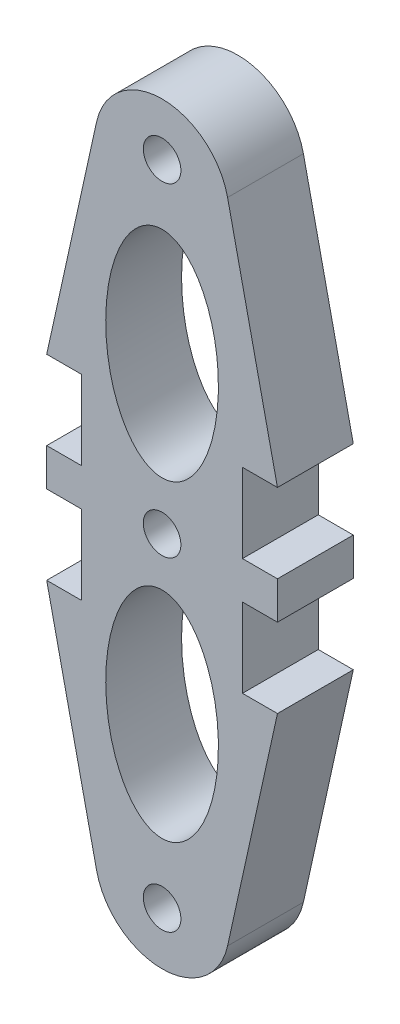
from build123d import *

# Parameters (mm, degrees)
SKETCH1_R           = 1.45
SKETCH1_RX          = 8.302080555
SKETCH1_RY          = 4.346497416
BOSS_EXTRUDE1_DEPTH = 5.85


with BuildPart() as part:
    # Sketch1 → Boss-Extrude1 (new body)
    with BuildSketch(Plane.XY):
        with BuildLine():
            Line((781.459168709, 464.852359197), (778.759168709, 464.852359197))
            Line((778.759168709, 464.852359197), (778.759168709, 461.952359197))
            Line((778.759168709, 461.952359197), (781.459168709, 461.952359197))
            Line((781.459168709, 461.952359197), (781.459168709, 455.852359197))
            Line((781.459168709, 455.852359197), (778.759168709, 455.852359197))
            Line((778.759168709, 455.852359197), (782.606547069, 438.402359197))
            ThreePointArc((782.606547069, 438.402359197), (787.659168709, 434.342389784), (792.711790348, 438.402359197))
            Line((792.711790348, 438.402359197), (796.559168709, 455.852359197))
            Line((796.559168709, 455.852359197), (793.859168709, 455.852359197))
            Line((793.859168709, 455.852359197), (793.859168709, 461.952359197))
            Line((793.859168709, 461.952359197), (796.559168709, 461.952359197))
            Line((796.559168709, 461.952359197), (796.559168709, 464.852359197))
            Line((796.559168709, 464.852359197), (793.859168709, 464.852359197))
            Line((793.859168709, 464.852359197), (793.859168709, 470.952359197))
            Line((793.859168709, 470.952359197), (796.559168709, 470.952359197))
            Line((796.559168709, 470.952359197), (792.711790348, 488.402359197))
            ThreePointArc((792.711790348, 488.402359197), (787.659168709, 492.46232861), (782.606547069, 488.402359197))
            Line((782.606547069, 488.402359197), (778.759168709, 470.952359197))
            Line((778.759168709, 470.952359197), (781.459168709, 470.952359197))
            Line((781.459168709, 470.952359197), (781.459168709, 464.852359197))
        make_face()
        with Locations((787.659168709, 488.402359197)):
            Circle(SKETCH1_R, mode=Mode.SUBTRACT)
        with Locations((787.659168709, 438.402359197)):
            Circle(SKETCH1_R, mode=Mode.SUBTRACT)
        with Locations((787.659168709, 463.402359197)):
            Circle(SKETCH1_R, mode=Mode.SUBTRACT)
        with Locations(Location((787.659168709, 475.448118238), (0, 0, 90))):
            Ellipse(SKETCH1_RX, SKETCH1_RY, mode=Mode.SUBTRACT)
        with Locations(Location((787.659168709, 451.356600156), (0, 0, -90))):
            Ellipse(SKETCH1_RX, SKETCH1_RY, mode=Mode.SUBTRACT)
    extrude(amount=BOSS_EXTRUDE1_DEPTH)


solid = part.part
